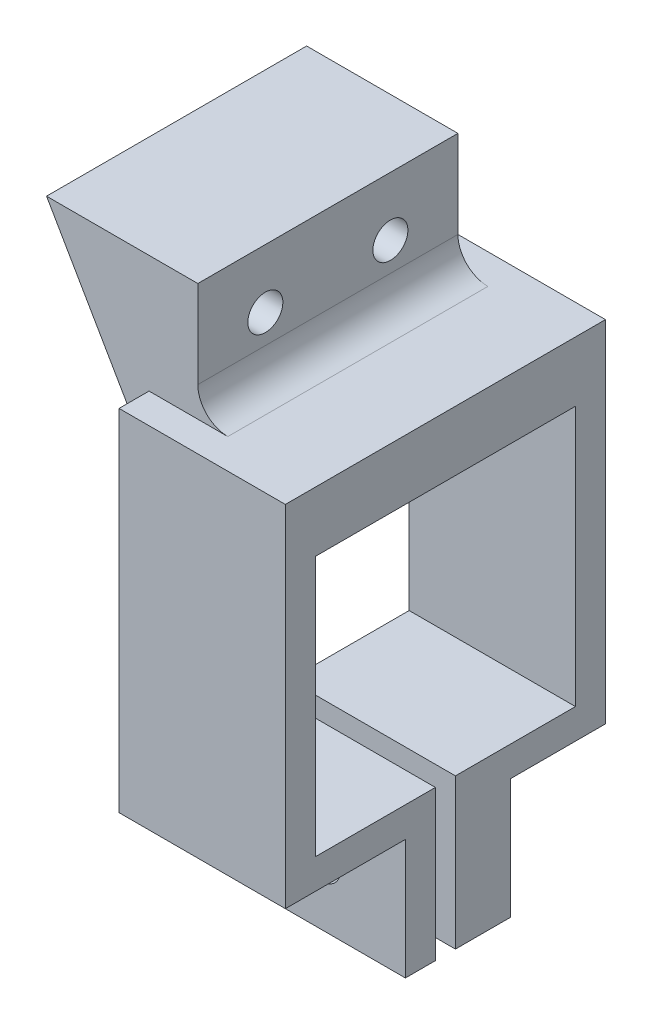
from build123d import *

# Parameters (mm, degrees)
BOSS_EXTRUDE1_DEPTH = 26
SKETCH3_R           = 1.75
CUT_EXTRUDE2_DEPTH  = 35.925597792
FILLET1_R           = 3
BOSS_EXTRUDE2_DEPTH = 16.626016
SKETCH5_R           = 1.8
CUT_EXTRUDE3_DEPTH  = 49.553315232
SKETCH6_W           = 16.626016361
SKETCH6_H           = 12
BOSS_EXTRUDE3_DEPTH = 2.5


with BuildPart() as part:
    # Sketch1 → Boss-Extrude1 (new body)
    with BuildSketch(Plane.XY):
        Polygon((0, 0), (-10.247967278, 17.75), (4.876016361, 17.75), (4.876016361, 6), (16.626016361, 6), (16.626016361, 0), align=None)
    extrude(amount=BOSS_EXTRUDE1_DEPTH)

    # Sketch3 → Cut-Extrude2 (cut, through all)
    with BuildSketch(Plane(origin=(4.876016361, 0, 0), x_dir=(0, 0, -1), z_dir=(1, 0, 0))):
        with Locations(Location((-19.25, 11.875, 0), (0, 0, 90))):
            Circle(SKETCH3_R)
        with Locations(Location((-6.75, 11.875, 0), (0, 0, 90))):
            Circle(SKETCH3_R)
    extrude(amount=-CUT_EXTRUDE2_DEPTH, mode=Mode.SUBTRACT)

    # Fillet1
    fillet1_edges = [part.edges().sort_by_distance(p)[0] for p in [
        (4.876016361, 6, 13),
    ]]
    fillet(fillet1_edges, radius=FILLET1_R)

    # Sketch4 → Boss-Extrude2 (add)
    with BuildSketch(Plane(origin=(16.626016361, 0, 0), x_dir=(0, 0, -1), z_dir=(1, 0, 0))):
        Polygon((-26, 6), (-29, 6), (-29, -29), (-17, -29), (-17, -41), (-14, -41), (-14, -26), (-26, -26), (-26, 0), align=None)
    boss_extrude2 = extrude(amount=-BOSS_EXTRUDE2_DEPTH)

    # Mirror1: Boss-Extrude2 across plane
    add(boss_extrude2.mirror(Plane(origin=(0, 0, 13), x_dir=(1, 0, 0), z_dir=(0, 0, -1))))

    # Sketch5 → Cut-Extrude3 (cut, through all)
    with BuildSketch(Plane.XY.offset(17)):
        with Locations(Location((8.31300818, -35, 0), (0, 0, 270))):
            Circle(SKETCH5_R)
    extrude(amount=-CUT_EXTRUDE3_DEPTH, mode=Mode.SUBTRACT)

    # Sketch6 → Boss-Extrude3 (add)
    with BuildSketch(Plane(origin=(0, 0, 9), x_dir=(-1, 0, 0), z_dir=(0, 0, -1))):
        with Locations((-8.313008181, -35)):
            Rectangle(SKETCH6_W, SKETCH6_H)
        Polygon((-5.51300818, -33.383419246), (-8.31300818, -31.766838493), (-11.11300818, -33.383419246), (-11.11300818, -36.616580754), (-8.31300818, -38.233161507), (-5.51300818, -36.616580754), align=None, mode=Mode.SUBTRACT)
    extrude(amount=BOSS_EXTRUDE3_DEPTH)


solid = part.part
